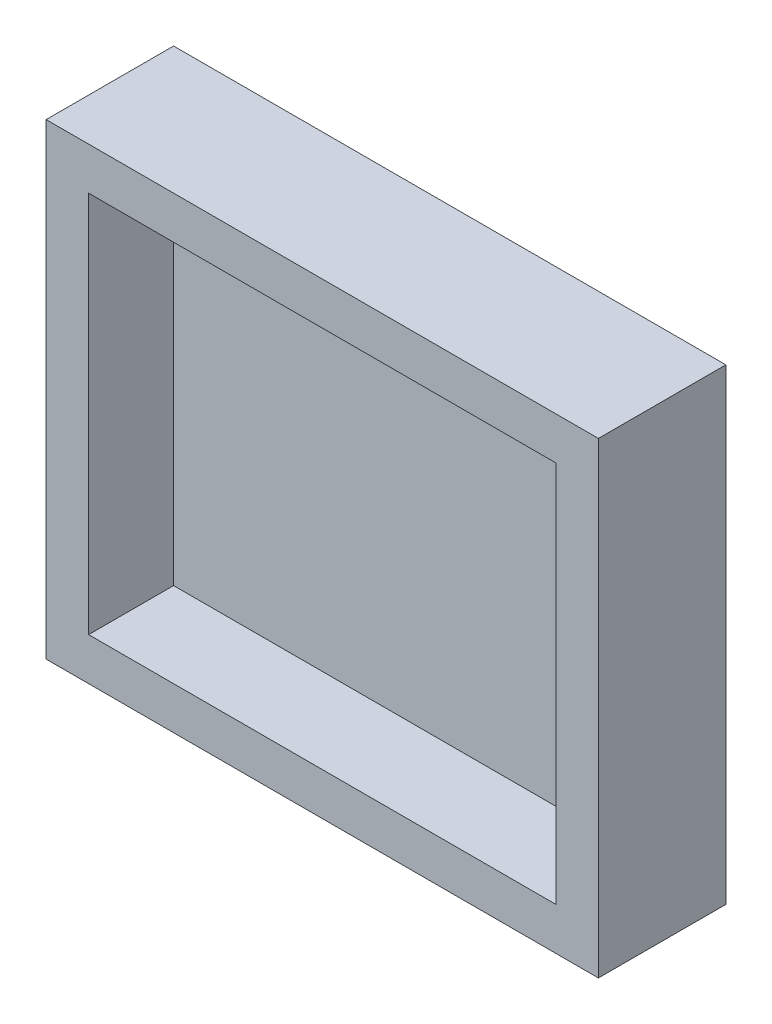
from build123d import *

# Parameters (mm, degrees)
ESQUISSE1_W             = 65
ESQUISSE1_H             = 55
BOSS_EXTRU_1_DEPTH      = 15
ESQUISSE2_W             = 55
ESQUISSE2_H             = 45
ENL_V_MAT_EXTRU_1_DEPTH = 10


with BuildPart() as part:
    # Esquisse1 → Boss.-Extru.1 (new body)
    with BuildSketch(Plane.XY):
        Rectangle(ESQUISSE1_W, ESQUISSE1_H)
    extrude(amount=BOSS_EXTRU_1_DEPTH)

    # Esquisse2 → Enlèv. mat.-Extru.1 (cut)
    with BuildSketch(Plane.XY.offset(15)):
        Rectangle(ESQUISSE2_W, ESQUISSE2_H)
    extrude(amount=-ENL_V_MAT_EXTRU_1_DEPTH, mode=Mode.SUBTRACT)


solid = part.part
